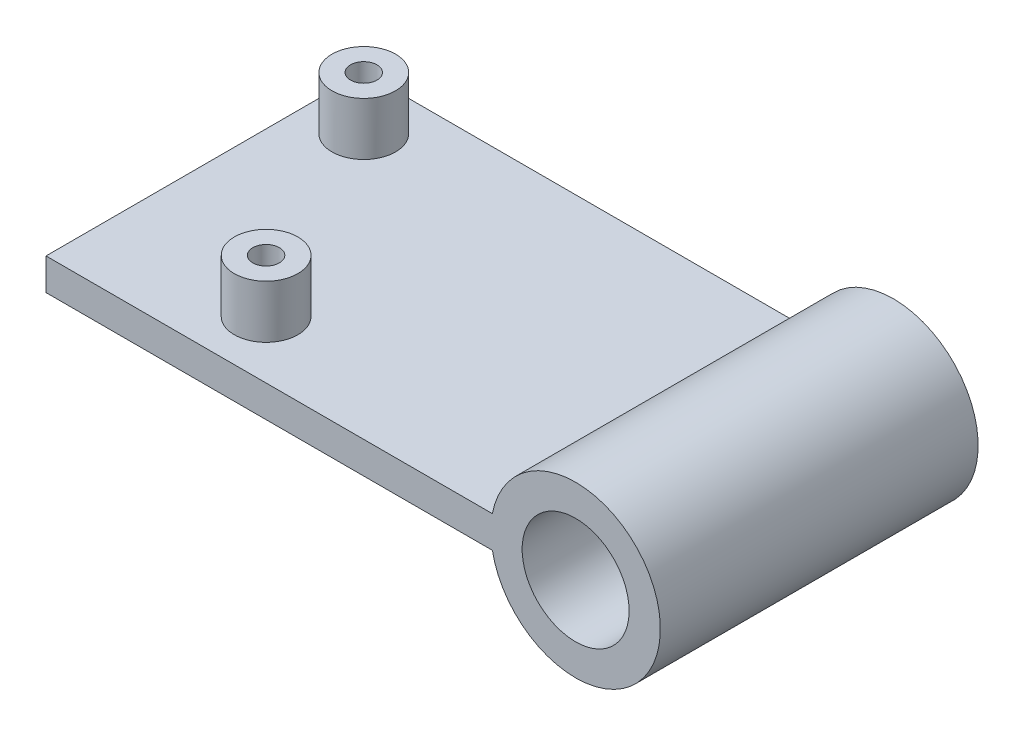
from build123d import *

# Parameters (mm, degrees)
SKETCH1_R           = 5.05
BOSS_EXTRUDE1_DEPTH = 30
SKETCH2_R           = 3
SKETCH2_R_2         = 1.25
BOSS_EXTRUDE2_DEPTH = 5


with BuildPart() as part:
    # Sketch1 → Boss-Extrude1 (new body)
    with BuildSketch(Plane.XY):
        with BuildLine():
            Line((-7.858116823, 1.5), (-50, 1.5))
            Line((-50, 1.5), (-50, -1.5))
            Line((-50, -1.5), (-7.858116823, -1.5))
            ThreePointArc((-7.858116823, -1.5), (8, 0), (-7.858116823, 1.5))
        make_face()
        Circle(SKETCH1_R, mode=Mode.SUBTRACT)
    extrude(amount=BOSS_EXTRUDE1_DEPTH)

    # Sketch2 → Boss-Extrude2 (add)
    # profile 1 of 2: a face of its own
    with BuildSketch(Plane(origin=(0, 1.5, 0), x_dir=(1, 0, 0), z_dir=(0, 1, 0))):
        with Locations(Location((-45, -5, 0), (0, 0, 90))):
            Circle(SKETCH2_R)
        with Locations(Location((-45, -5, 0), (0, 0, 270))):
            Circle(SKETCH2_R_2, mode=Mode.SUBTRACT)
    # profile 2 of 2: a face of its own
    with BuildSketch(Plane(origin=(0, 1.5, 0), x_dir=(1, 0, 0), z_dir=(0, 1, 0))):
        with Locations(Location((-34.6622, -24.558, 0), (0, 0, 90))):
            Circle(SKETCH2_R)
        with Locations(Location((-34.6622, -24.558, 0), (0, 0, 270))):
            Circle(SKETCH2_R_2, mode=Mode.SUBTRACT)
    extrude(amount=BOSS_EXTRUDE2_DEPTH)


solid = part.part
